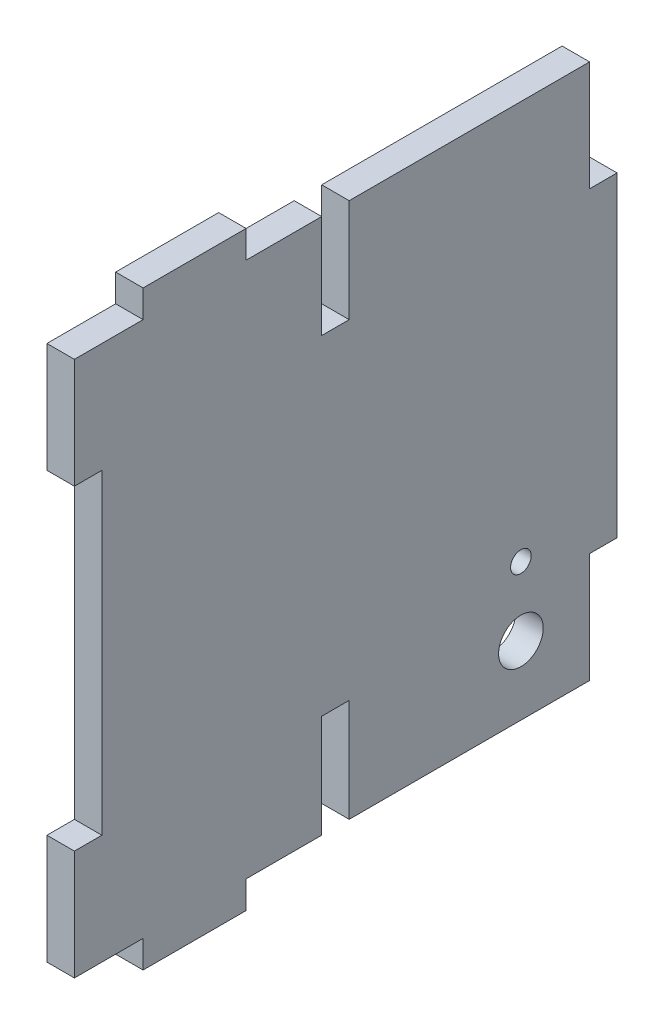
from build123d import *

# Parameters (mm, degrees)
BOSS_EXTRUDE1_DEPTH = 4
SKETCH2_R           = 3.25
SKETCH2_R_2         = 1.5
CUT_EXTRUDE1_DEPTH  = 114.934191532


with BuildPart() as part:
    # Sketch1 → Boss-Extrude1 (new body)
    with BuildSketch(Plane(origin=(0, 0, 0), x_dir=(0, 0, -1), z_dir=(1, 0, 0))):
        Polygon((10, 0), (10, -4), (25, -4), (25, 0), (36, 0), (36, 15), (40, 15), (40, 0), (75, 0), (75, 16), (79, 16), (79, 62), (75, 62), (75, 78), (40, 78), (40, 63), (36, 63), (36, 78), (25, 78), (25, 82), (10, 82), (10, 78), (0, 78), (0, 62), (4, 62), (4, 16), (0, 16), (0, 0), align=None)
    extrude(amount=BOSS_EXTRUDE1_DEPTH)

    # Sketch2 → Cut-Extrude1 (cut, through all)
    with BuildSketch(Plane(origin=(4, 0, 0), x_dir=(0, 0, -1), z_dir=(1, 0, 0))):
        with Locations((65, 10)):
            Circle(SKETCH2_R)
        with Locations((65, 20)):
            Circle(SKETCH2_R_2)
    extrude(amount=-CUT_EXTRUDE1_DEPTH, mode=Mode.SUBTRACT)


solid = part.part
